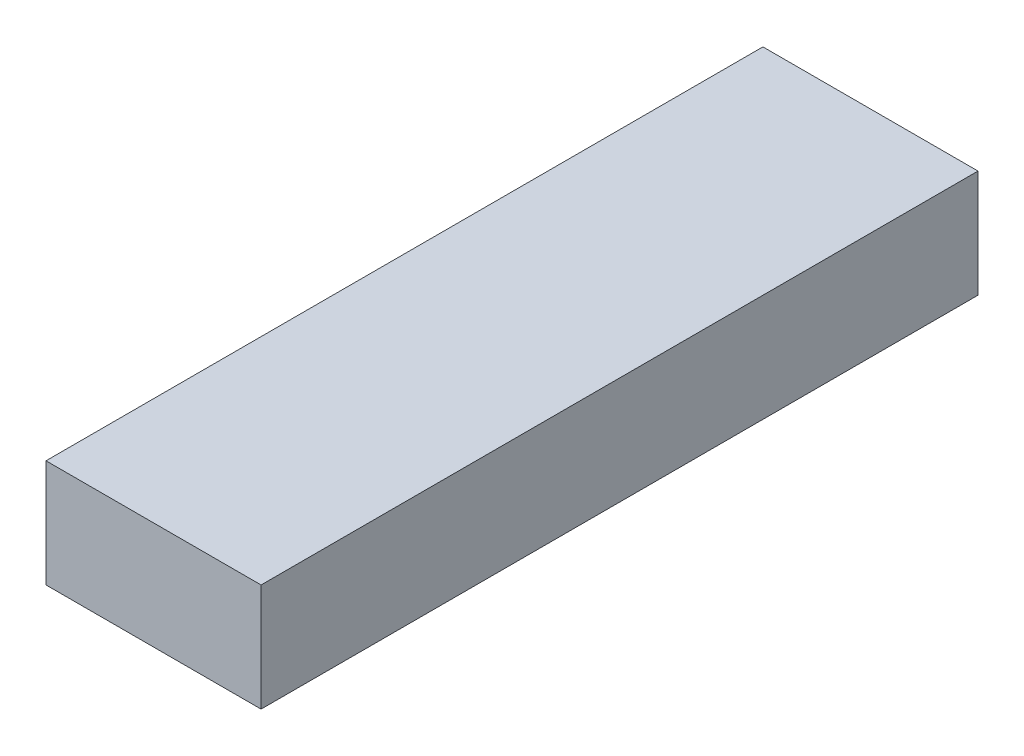
from build123d import *

# Parameters (mm, degrees)
SKETCH_1_W      = 60
SKETCH_1_H      = 30
EXTRUDE_1_DEPTH = 200


with BuildPart() as part:
    # 스케치1 → 보스-돌출1 (new body)
    with BuildSketch(Plane.XY):
        Rectangle(SKETCH_1_W, SKETCH_1_H)
    extrude(amount=EXTRUDE_1_DEPTH)


solid = part.part
